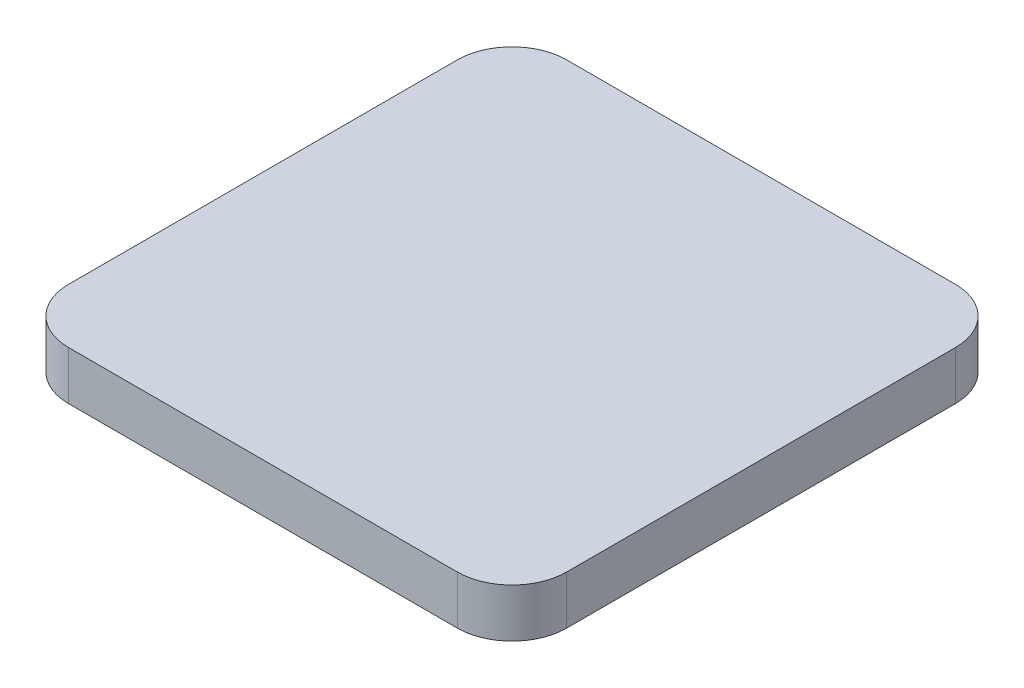
from build123d import *

# Parameters (mm, degrees)
EXTRUDE_1_DEPTH = 4


with BuildPart() as part:
    # Extrude sketch 1 → Extrude 1 (new body)
    with BuildSketch(Plane(origin=(0, 0, 0), x_dir=(1, 0, 0), z_dir=(0, 1, 0))):
        with BuildLine():
            Line((20.5, 16), (20.5, -16))
            ThreePointArc((20.5, -16), (19.181980515, -19.181980515), (16, -20.5))
            Line((16, -20.5), (-16, -20.5))
            ThreePointArc((-16, -20.5), (-19.181980515, -19.181980515), (-20.5, -16))
            Line((-20.5, -16), (-20.5, 16))
            ThreePointArc((-20.5, 16), (-19.181980515, 19.181980515), (-16, 20.5))
            Line((-16, 20.5), (16, 20.5))
            ThreePointArc((16, 20.5), (19.181980515, 19.181980515), (20.5, 16))
        make_face()
    extrude(amount=EXTRUDE_1_DEPTH)


solid = part.part
